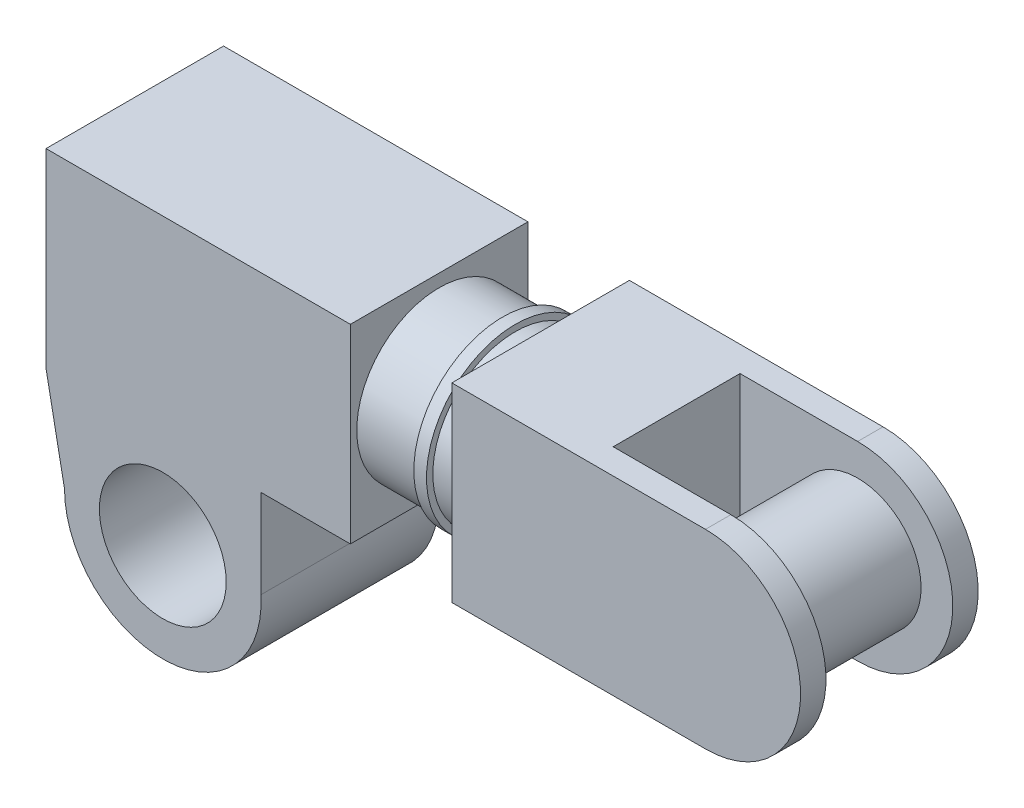
from build123d import *

# Parameters (mm, degrees)
SKETCH1_W           = 1400
SKETCH1_H           = 1500
BOSS_EXTRUDE1_DEPTH = 2400
SKETCH2_R           = 650
BOSS_EXTRUDE2_DEPTH = 500
SKETCH3_R           = 700
BOSS_EXTRUDE3_DEPTH = 100
SKETCH4_R           = 500
BOSS_EXTRUDE4_DEPTH = 1400
SKETCH5_R           = 650
BOSS_EXTRUDE5_DEPTH = 200
BOSS_EXTRUDE7_DEPTH = 700
CUT_EXTRUDE1_DEPTH  = 500
BOSS_EXTRUDE8_REACH = 6524.126
SKETCH8_R           = 500


with BuildPart() as part:
    # Sketch1 → Boss-Extrude1 (new body)
    with BuildSketch(Plane(origin=(0, 0, 0), x_dir=(0, 0, -1), z_dir=(1, 0, 0))):
        Rectangle(SKETCH1_W, SKETCH1_H)
    extrude(amount=BOSS_EXTRUDE1_DEPTH)

    # Sketch2 → Boss-Extrude2 (add)
    with BuildSketch(Plane(origin=(2400, 0, 0), x_dir=(0, 0, -1), z_dir=(1, 0, 0))):
        Circle(SKETCH2_R)
    extrude(amount=BOSS_EXTRUDE2_DEPTH)

    # Sketch3 → Boss-Extrude3 (add)
    with BuildSketch(Plane(origin=(2900, 0, 0), x_dir=(0, 0, -1), z_dir=(1, 0, 0))):
        Circle(SKETCH3_R)
    extrude(amount=BOSS_EXTRUDE3_DEPTH)

    # Sketch4 → Boss-Extrude4 (add)
    with BuildSketch(Plane.XY.offset(700)):
        with BuildLine():
            Line((1695.785231853, -750), (0, -750))
            Line((0, -750), (145.785231853, -1500))
            ThreePointArc((145.785231853, -1500), (945.798262882, -2274.596248557), (1694.170646766, -1450))
            Line((1694.170646766, -1450), (1695.785231853, -750))
        make_face()
        with Locations((920.785231853, -1500)):
            Circle(SKETCH4_R, mode=Mode.SUBTRACT)
    extrude(amount=-BOSS_EXTRUDE4_DEPTH)

    # Sketch5 → Boss-Extrude5 (add)
    with BuildSketch(Plane(origin=(3000, 0, 0), x_dir=(0, 0, -1), z_dir=(1, 0, 0))):
        Circle(SKETCH5_R)
    extrude(amount=BOSS_EXTRUDE5_DEPTH)

    # Sketch6 → Boss-Extrude7 (add, symmetric)
    with BuildSketch(Plane.XY):
        with BuildLine():
            Line((5200, 750), (3200, 750))
            Line((3200, 750), (3200, -750))
            Line((3200, -750), (5200, -750))
            ThreePointArc((5200, -750), (5950, 0), (5200, 750))
        make_face()
    extrude(amount=BOSS_EXTRUDE7_DEPTH, both=True)

    # Sketch7 → Cut-Extrude1 (cut, symmetric)
    with BuildSketch(Plane.XY):
        with BuildLine():
            Line((5200, 750), (4272.376484701, 750))
            Line((4272.376484701, 750), (4272.376484701, -750))
            Line((4272.376484701, -750), (5200, -750))
            ThreePointArc((5200, -750), (5950, 0), (5200, 750))
        make_face()
    extrude(amount=CUT_EXTRUDE1_DEPTH, both=True, mode=Mode.SUBTRACT)

    # Sketch8 → Boss-Extrude8 (add, up to next)
    with BuildSketch(Plane.XY.offset(700), mode=Mode.PRIVATE) as boss_extrude8_sk1:
        with Locations((5200, 0)):
            Circle(SKETCH8_R)
    boss_extrude8_tool1 = extrude(boss_extrude8_sk1.sketch, amount=-BOSS_EXTRUDE8_REACH, mode=Mode.PRIVATE) - part.part
    add(boss_extrude8_tool1.solids().sort_by_distance((5200, 0, 700))[0])


solid = part.part
